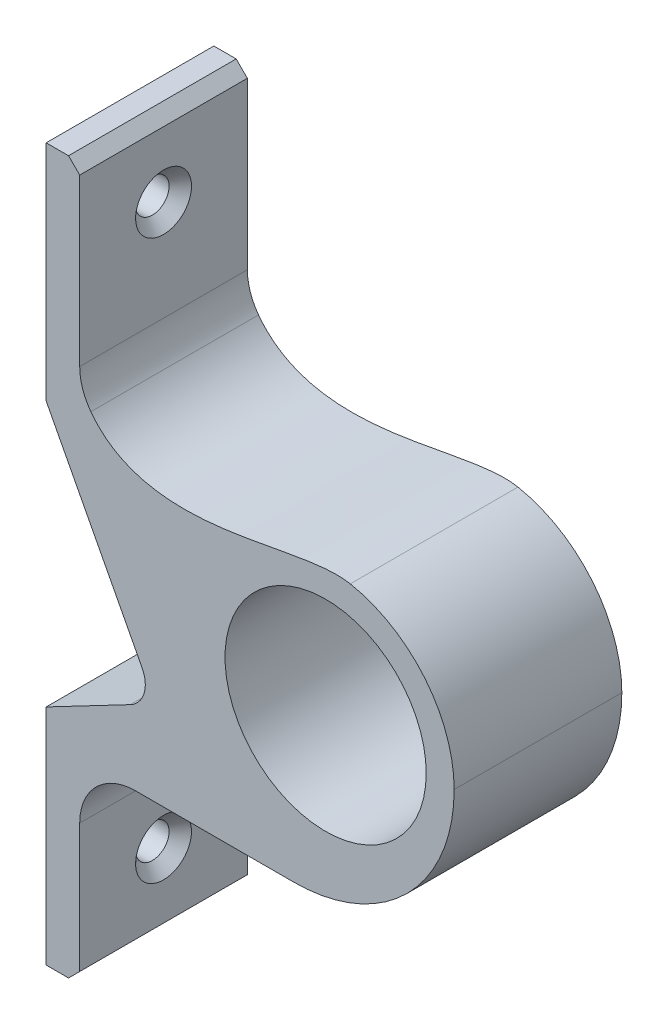
from build123d import *

# Parameters (mm, degrees)
BOSS_EXTRUDE2_DEPTH = 15
SKETCH7_R           = 3
CUT_EXTRUDE3_DEPTH  = 99.043475892
CHAMFER1_SIZE       = 2


with BuildPart() as part:
    # Sketch5 → Boss-Extrude2 (new, symmetric)
    with BuildSketch(Plane.XY):
        with BuildLine():
            Line((15.0591361, -15.818420273), (0, -23.706539182))
            Line((0, -23.706539182), (0, -63.706539182))
            Line((0, -63.706539182), (6, -63.706539182))
            Line((6, -63.706539182), (6, -38.706539182))
            ThreePointArc((6, -38.706539182), (8.928932188, -31.63547137), (16, -28.706539182))
            Line((16, -28.706539182), (44.293460818, -28.706539182))
            ThreePointArc((44.293460818, -28.706539182), (64.592049338, -20.29858852), (73, 0))
            ThreePointArc((73, 0), (71.8467278, 7.191695517), (68.502566573, 13.662175164))
            ThreePointArc((68.502566573, 13.662175164), (68.128388929, 12.868245276), (68, 12))
            Line((68, 12), (68, 0))
            ThreePointArc((68, 0), (55.687961475, -17.077678246), (35.594767305, -10.793019549))
            Line((35.594767305, -10.793019549), (7.997092947, 26.041058175))
            ThreePointArc((7.997092947, 26.041058175), (6.512400975, 28.87720155), (6, 32.037180147))
            Line((6, 32.037180147), (6, 63.706539182))
            Line((6, 63.706539182), (0, 63.706539182))
            Line((0, 63.706539182), (0, 23.706539182))
            Line((0, 23.706539182), (17.168258803, -9.069227623))
            ThreePointArc((17.168258803, -9.069227623), (17.511501017, -12.880637562), (15.0591361, -15.818420273))
        make_face()
        with BuildLine():
            ThreePointArc((68, 12), (68.128388929, 12.868245276), (68.502566573, 13.662175164))
            ThreePointArc((68.502566573, 13.662175164), (62.293432752, 19.438917438), (54.41285467, 22.572698413))
            add(Edge.make_bspline(
                [(54.41285467, 22.572698413), (48.698801755, 23.689768452), (29.182846067, 17.084288793), (12.266368885, 20.342938845), (7.997092947, 26.041058175)],
                knots=[0, 0, 0, 0, 0.577740896, 1, 1, 1, 1], degree=3))
            Line((7.997092947, 26.041058175), (35.594767305, -10.793019549))
            ThreePointArc((35.594767305, -10.793019549), (44.312038525, 17.077678246), (68, 0))
            Line((68, 0), (68, 12))
        make_face()
    extrude(amount=BOSS_EXTRUDE2_DEPTH, both=True)

    # Sketch7 → Cut-Extrude3 (cut, through all)
    with BuildSketch(Plane(origin=(0, 0, 0), x_dir=(0, 0, -1), z_dir=(1, 0, 0))):
        with Locations(Location((0, -50, 0), (0, 0, 270))):
            Circle(SKETCH7_R)
        with Locations(Location((0, 50, 0), (0, 0, 90))):
            Circle(SKETCH7_R)
    extrude(amount=CUT_EXTRUDE3_DEPTH, mode=Mode.SUBTRACT)

    # Chamfer1
    chamfer1_edges = [part.edges().sort_by_distance(p)[0] for p in [
        (6, -63.706539182, 0),
        (6, 63.706539182, 0),
        (6, -47, 0),
        (6, 47, 0),
    ]]
    chamfer(chamfer1_edges, length=CHAMFER1_SIZE)


solid = part.part
